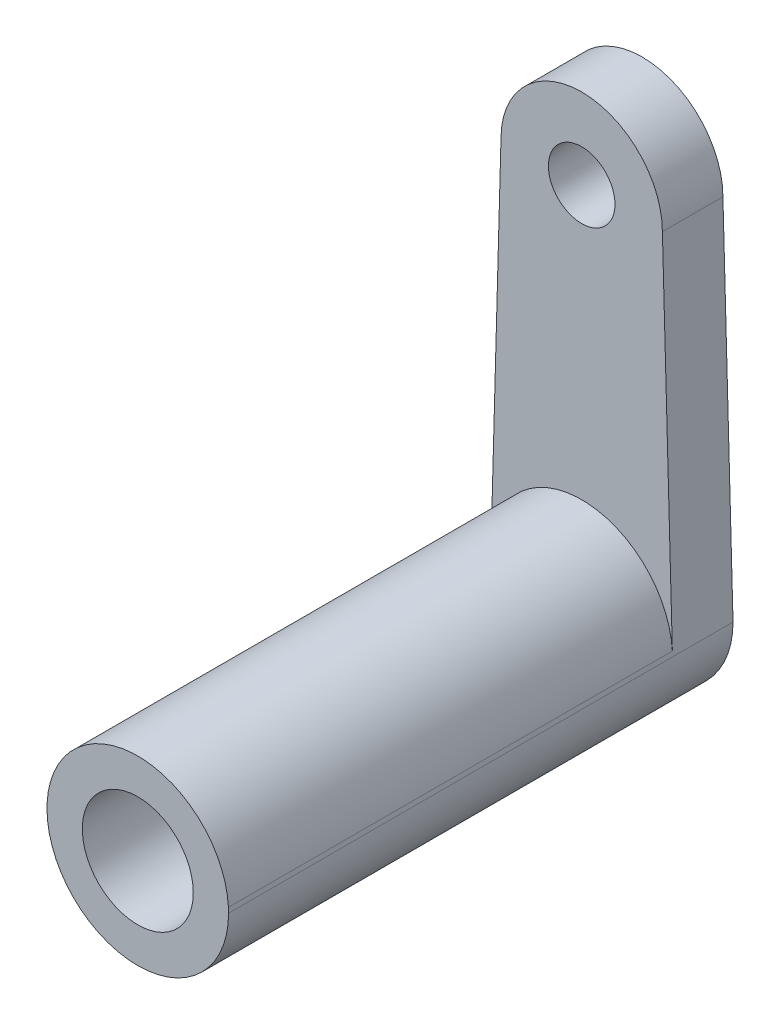
from build123d import *

# Parameters (mm, degrees)
SKETCH_1_R          = 1.65
EXTRUDE_3_DEPTH     = 3
EXTRUDE_5_DEPTH     = 25
CUT_EXTRUDE_START   = 15
CUT_EXTRUDE_1_DEPTH = 10


with BuildPart() as part:
    # 草图1 → 凸台-拉伸3 (new body)
    with BuildSketch(Plane.XY):
        with BuildLine():
            ThreePointArc((-4.5, 0), (0, -4.5), (4.5, 0))
            Line((4.5, 0), (4, 18))
            ThreePointArc((4, 18), (0, 22), (-4, 18))
            Line((-4, 18), (-4.5, 0))
        make_face()
        with Locations((0, 18)):
            Circle(SKETCH_1_R, mode=Mode.SUBTRACT)
        with BuildLine():
            Line((-1.887458609, 2), (1.887458609, 2))
            ThreePointArc((1.887458609, 2), (0, -2.75), (-1.887458609, 2))
        make_face(mode=Mode.SUBTRACT)
    extrude(amount=EXTRUDE_3_DEPTH)

    # 草图1<12> → 凸台-拉伸5 (add)
    with BuildSketch(Plane.XY):
        with BuildLine():
            Line((-4.49306091, 0.249807247), (-4.5, 0))
            ThreePointArc((-4.5, 0), (0, -4.5), (4.5, 0))
            Line((4.5, 0), (4.49306091, 0.249807247))
            ThreePointArc((4.49306091, 0.249807247), (0, 4.5), (-4.49306091, 0.249807247))
        make_face()
        with BuildLine():
            Line((-1.887458609, 2), (1.887458609, 2))
            ThreePointArc((1.887458609, 2), (0, -2.75), (-1.887458609, 2))
        make_face(mode=Mode.SUBTRACT)
    extrude(amount=EXTRUDE_5_DEPTH)

    # 草图1<16> → 切除-拉伸1 (cut)
    with BuildSketch(Plane.XY.offset(CUT_EXTRUDE_START)):
        with BuildLine():
            ThreePointArc((0, 2.75), (-1.015504801, 2.555631038), (-1.887458609, 2))
            Line((-1.887458609, 2), (0, 2))
            Line((0, 2), (0, 2.75))
        make_face()
        with BuildLine():
            Line((0, 2), (-1.887458609, 2))
            ThreePointArc((-1.887458609, 2), (-2.555631038, -1.015504801), (0, -2.75))
            Line((0, -2.75), (0, 2))
        make_face()
        with BuildLine():
            Line((0, 2.75), (0, 2))
            Line((0, 2), (1.887458609, 2))
            ThreePointArc((1.887458609, 2), (1.015504801, 2.555631038), (0, 2.75))
        make_face()
        with BuildLine():
            Line((1.887458609, 2), (0, 2))
            Line((0, 2), (0, -2.75))
            ThreePointArc((0, -2.75), (1.944543648, -1.944543648), (2.75, 0))
            ThreePointArc((2.75, 0), (2.525174368, 1.089033706), (1.887458609, 2))
        make_face()
    extrude(amount=CUT_EXTRUDE_1_DEPTH, mode=Mode.SUBTRACT)


solid = part.part
